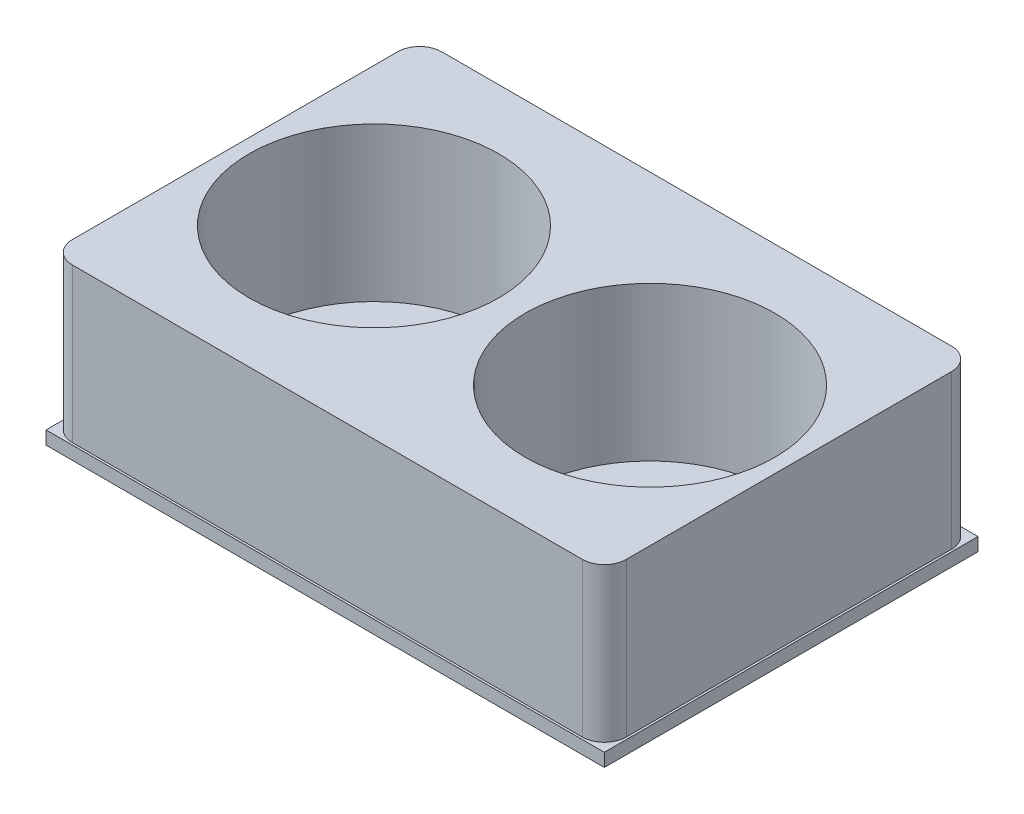
from build123d import *

# Parameters (mm, degrees)
SKETCH2_W           = 126
SKETCH2_H           = 84
SKETCH2_R           = 28.4
BOSS_EXTRUDE1_DEPTH = 35
SKETCH3_W           = 127
SKETCH3_H           = 85
BOSS_EXTRUDE2_DEPTH = 3
FILLET1_R           = 5


with BuildPart() as part:
    # Sketch2 → Boss-Extrude1 (new body)
    with BuildSketch(Plane(origin=(0, 0, 0), x_dir=(1, 0, 0), z_dir=(0, 1, 0))):
        with Locations((63, 42)):
            Rectangle(SKETCH2_W, SKETCH2_H)
        with Locations(Location((31.6, 42, 0), (0, 0, 270))):
            Circle(SKETCH2_R, mode=Mode.SUBTRACT)
        with Locations(Location((94.4, 42, 0), (0, 0, 270))):
            Circle(SKETCH2_R, mode=Mode.SUBTRACT)
    extrude(amount=BOSS_EXTRUDE1_DEPTH)

    # Sketch3 → Boss-Extrude2 (add)
    with BuildSketch(Plane.XZ):
        with Locations((63, -42)):
            Rectangle(SKETCH3_W, SKETCH3_H)
    extrude(amount=BOSS_EXTRUDE2_DEPTH)

    # Fillet1
    fillet1_edges = [part.edges().sort_by_distance(p)[0] for p in [
        (0, 17.5, -84),
        (126, 17.5, -84),
        (126, 17.5, 0),
        (0, 17.5, 0),
    ]]
    fillet(fillet1_edges, radius=FILLET1_R)


solid = part.part
